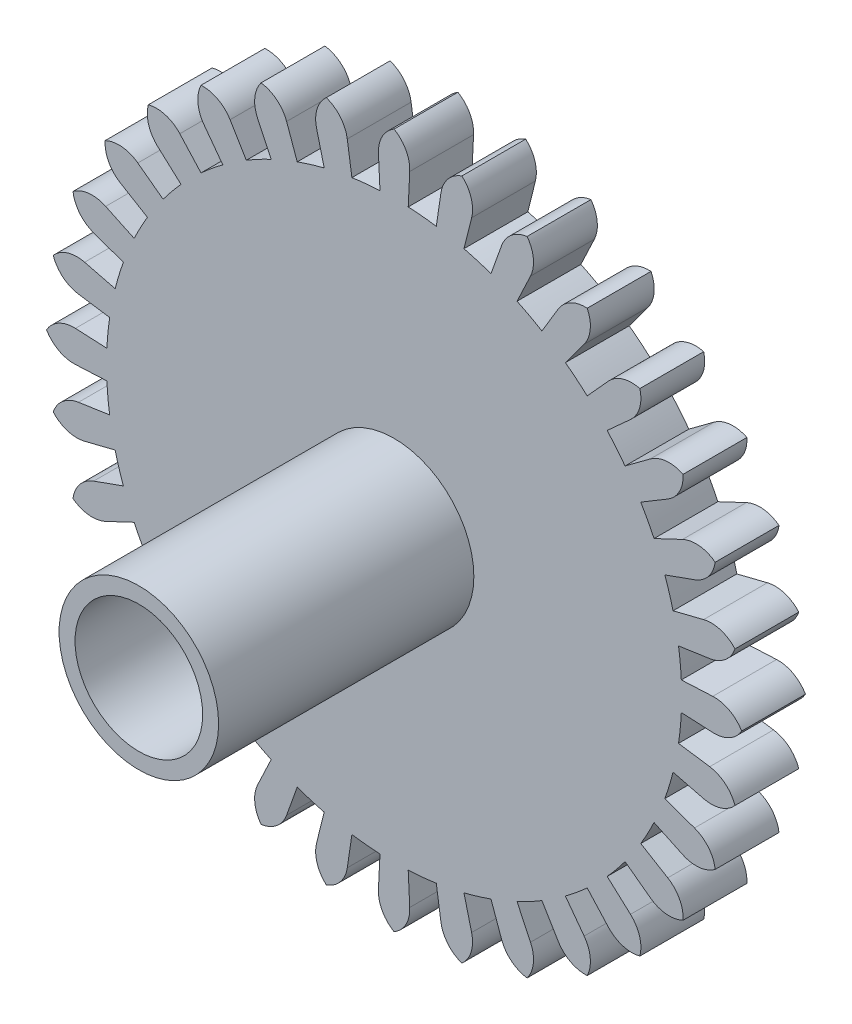
from build123d import *

# Parameters (mm, degrees)
SKETCH2_R           = 1
BOSS_EXTRUDE1_DEPTH = 0.8
SKETCH2_3_R         = 1
SKETCH2_3_R_2       = 0.8
BOSS_EXTRUDE2_DEPTH = 4


with BuildPart() as part:
    # Sketch2 → Boss-Extrude1 (new body)
    with BuildSketch(Plane.XY):
        with BuildLine():
            Line((-0.196290851, 3.995180835), (-0.176907129, 3.600656727))
            ThreePointArc((-0.176907129, 3.600656727), (-0.353351791, 3.58764094), (-0.528945372, 3.565983987))
            Line((-0.528945372, 3.565983987), (-0.586901938, 3.956709001))
            ThreePointArc((-0.586901938, 3.956709001), (-0.674147678, 4.152028122), (-0.850092422, 4.273703204))
            ThreePointArc((-0.850092422, 4.273703204), (-0.966081131, 4.093958948), (-0.971940293, 3.88012011))
            Line((-0.971940293, 3.88012011), (-0.875961189, 3.496958249))
            ThreePointArc((-0.875961189, 3.496958249), (-1.046476262, 3.44976991), (-1.214470799, 3.394272481))
            Line((-1.214470799, 3.394272481), (-1.347540415, 3.766183058))
            ThreePointArc((-1.347540415, 3.766183058), (-1.471214623, 3.940728378), (-1.667516269, 4.025740391))
            ThreePointArc((-1.667516269, 4.025740391), (-1.746209923, 3.826821596), (-1.710238614, 3.615948545))
            Line((-1.710238614, 3.615948545), (-1.541352551, 3.258873626))
            ThreePointArc((-1.541352551, 3.258873626), (-1.699385236, 3.179326158), (-1.853324795, 3.092120988))
            Line((-1.853324795, 3.092120988), (-2.05639367, 3.430924813))
            ThreePointArc((-2.05639367, 3.430924813), (-2.211743615, 3.577988653), (-2.4208584, 3.623070633))
            ThreePointArc((-2.4208584, 3.623070633), (-2.459232846, 3.412621636), (-2.382813425, 3.212818106))
            Line((-2.382813425, 3.212818106), (-2.147510599, 2.895552318))
            ThreePointArc((-2.147510599, 2.895552318), (-2.286987789, 2.786702684), (-2.420956558, 2.671141019))
            Line((-2.420956558, 2.671141019), (-2.686220869, 2.963818052))
            ThreePointArc((-2.686220869, 2.963818052), (-2.86727654, 3.07774883), (-3.081168302, 3.081168302))
            ThreePointArc((-3.081168302, 3.081168302), (-3.07774883, 2.86727654), (-2.963818052, 2.686220869))
            Line((-2.963818052, 2.686220869), (-2.671141019, 2.420956558))
            ThreePointArc((-2.671141019, 2.420956558), (-2.786702684, 2.286987789), (-2.895552318, 2.147510599))
            Line((-2.895552318, 2.147510599), (-3.212818106, 2.382813425))
            ThreePointArc((-3.212818106, 2.382813425), (-3.412621636, 2.459232846), (-3.623070633, 2.4208584))
            ThreePointArc((-3.623070633, 2.4208584), (-3.577988653, 2.211743615), (-3.430924813, 2.05639367))
            Line((-3.430924813, 2.05639367), (-3.092120988, 1.853324795))
            ThreePointArc((-3.092120988, 1.853324795), (-3.179326158, 1.699385236), (-3.258873626, 1.541352551))
            Line((-3.258873626, 1.541352551), (-3.615948545, 1.710238614))
            ThreePointArc((-3.615948545, 1.710238614), (-3.826821596, 1.746209923), (-4.025740391, 1.667516269))
            ThreePointArc((-4.025740391, 1.667516269), (-3.940728378, 1.471214623), (-3.766183058, 1.347540415))
            Line((-3.766183058, 1.347540415), (-3.394272481, 1.214470799))
            ThreePointArc((-3.394272481, 1.214470799), (-3.44976991, 1.046476262), (-3.496958249, 0.875961189))
            Line((-3.496958249, 0.875961189), (-3.88012011, 0.971940293))
            ThreePointArc((-3.88012011, 0.971940293), (-4.093958948, 0.966081131), (-4.273703204, 0.850092422))
            ThreePointArc((-4.273703204, 0.850092422), (-4.152028122, 0.674147678), (-3.956709001, 0.586901938))
            Line((-3.956709001, 0.586901938), (-3.565983987, 0.528945372))
            ThreePointArc((-3.565983987, 0.528945372), (-3.58764094, 0.353351791), (-3.600656727, 0.176907129))
            Line((-3.600656727, 0.176907129), (-3.995180835, 0.196290851))
            ThreePointArc((-3.995180835, 0.196290851), (-4.203767754, 0.148826384), (-4.35743, 0))
            ThreePointArc((-4.35743, 0), (-4.203767754, -0.148826384), (-3.995180835, -0.196290851))
            Line((-3.995180835, -0.196290851), (-3.600656727, -0.176907129))
            ThreePointArc((-3.600656727, -0.176907129), (-3.58764094, -0.353351791), (-3.565983987, -0.528945372))
            Line((-3.565983987, -0.528945372), (-3.956709001, -0.586901938))
            ThreePointArc((-3.956709001, -0.586901938), (-4.152028122, -0.674147678), (-4.273703204, -0.850092422))
            ThreePointArc((-4.273703204, -0.850092422), (-4.093958948, -0.966081131), (-3.88012011, -0.971940293))
            Line((-3.88012011, -0.971940293), (-3.496958249, -0.875961189))
            ThreePointArc((-3.496958249, -0.875961189), (-3.44976991, -1.046476262), (-3.394272481, -1.214470799))
            Line((-3.394272481, -1.214470799), (-3.766183058, -1.347540415))
            ThreePointArc((-3.766183058, -1.347540415), (-3.940728378, -1.471214623), (-4.025740391, -1.667516269))
            ThreePointArc((-4.025740391, -1.667516269), (-3.826821596, -1.746209923), (-3.615948545, -1.710238614))
            Line((-3.615948545, -1.710238614), (-3.258873626, -1.541352551))
            ThreePointArc((-3.258873626, -1.541352551), (-3.179326158, -1.699385236), (-3.092120988, -1.853324795))
            Line((-3.092120988, -1.853324795), (-3.430924813, -2.05639367))
            ThreePointArc((-3.430924813, -2.05639367), (-3.577988653, -2.211743615), (-3.623070633, -2.4208584))
            ThreePointArc((-3.623070633, -2.4208584), (-3.412621636, -2.459232846), (-3.212818106, -2.382813425))
            Line((-3.212818106, -2.382813425), (-2.895552318, -2.147510599))
            ThreePointArc((-2.895552318, -2.147510599), (-2.786702684, -2.286987789), (-2.671141019, -2.420956558))
            Line((-2.671141019, -2.420956558), (-2.963818052, -2.686220869))
            ThreePointArc((-2.963818052, -2.686220869), (-3.07774883, -2.86727654), (-3.081168302, -3.081168302))
            ThreePointArc((-3.081168302, -3.081168302), (-2.86727654, -3.07774883), (-2.686220869, -2.963818052))
            Line((-2.686220869, -2.963818052), (-2.420956558, -2.671141019))
            ThreePointArc((-2.420956558, -2.671141019), (-2.286987789, -2.786702684), (-2.147510599, -2.895552318))
            Line((-2.147510599, -2.895552318), (-2.382813425, -3.212818106))
            ThreePointArc((-2.382813425, -3.212818106), (-2.459232846, -3.412621636), (-2.4208584, -3.623070633))
            ThreePointArc((-2.4208584, -3.623070633), (-2.211743615, -3.577988653), (-2.05639367, -3.430924813))
            Line((-2.05639367, -3.430924813), (-1.853324795, -3.092120988))
            ThreePointArc((-1.853324795, -3.092120988), (-1.699385236, -3.179326158), (-1.541352551, -3.258873626))
            Line((-1.541352551, -3.258873626), (-1.710238614, -3.615948545))
            ThreePointArc((-1.710238614, -3.615948545), (-1.746209923, -3.826821596), (-1.667516269, -4.025740391))
            ThreePointArc((-1.667516269, -4.025740391), (-1.471214623, -3.940728378), (-1.347540415, -3.766183058))
            Line((-1.347540415, -3.766183058), (-1.214470799, -3.394272481))
            ThreePointArc((-1.214470799, -3.394272481), (-1.046476262, -3.44976991), (-0.875961189, -3.496958249))
            Line((-0.875961189, -3.496958249), (-0.971940293, -3.88012011))
            ThreePointArc((-0.971940293, -3.88012011), (-0.966081131, -4.093958948), (-0.850092422, -4.273703204))
            ThreePointArc((-0.850092422, -4.273703204), (-0.674147678, -4.152028122), (-0.586901938, -3.956709001))
            Line((-0.586901938, -3.956709001), (-0.528945372, -3.565983987))
            ThreePointArc((-0.528945372, -3.565983987), (-0.353351791, -3.58764094), (-0.176907129, -3.600656727))
            Line((-0.176907129, -3.600656727), (-0.196290851, -3.995180835))
            ThreePointArc((-0.196290851, -3.995180835), (-0.148826384, -4.203767754), (0, -4.35743))
            ThreePointArc((0, -4.35743), (0.148826384, -4.203767754), (0.196290851, -3.995180835))
            Line((0.196290851, -3.995180835), (0.176907129, -3.600656727))
            ThreePointArc((0.176907129, -3.600656727), (0.353351791, -3.58764094), (0.528945372, -3.565983987))
            Line((0.528945372, -3.565983987), (0.586901938, -3.956709001))
            ThreePointArc((0.586901938, -3.956709001), (0.674147678, -4.152028122), (0.850092422, -4.273703204))
            ThreePointArc((0.850092422, -4.273703204), (0.966081131, -4.093958948), (0.971940293, -3.88012011))
            Line((0.971940293, -3.88012011), (0.875961189, -3.496958249))
            ThreePointArc((0.875961189, -3.496958249), (1.046476262, -3.44976991), (1.214470799, -3.394272481))
            Line((1.214470799, -3.394272481), (1.347540415, -3.766183058))
            ThreePointArc((1.347540415, -3.766183058), (1.471214623, -3.940728378), (1.667516269, -4.025740391))
            ThreePointArc((1.667516269, -4.025740391), (1.746209923, -3.826821596), (1.710238614, -3.615948545))
            Line((1.710238614, -3.615948545), (1.541352551, -3.258873626))
            ThreePointArc((1.541352551, -3.258873626), (1.699385236, -3.179326158), (1.853324795, -3.092120988))
            Line((1.853324795, -3.092120988), (2.05639367, -3.430924813))
            ThreePointArc((2.05639367, -3.430924813), (2.211743615, -3.577988653), (2.4208584, -3.623070633))
            ThreePointArc((2.4208584, -3.623070633), (2.459232846, -3.412621636), (2.382813425, -3.212818106))
            Line((2.382813425, -3.212818106), (2.147510599, -2.895552318))
            ThreePointArc((2.147510599, -2.895552318), (2.286987789, -2.786702684), (2.420956558, -2.671141019))
            Line((2.420956558, -2.671141019), (2.686220869, -2.963818052))
            ThreePointArc((2.686220869, -2.963818052), (2.86727654, -3.07774883), (3.081168302, -3.081168302))
            ThreePointArc((3.081168302, -3.081168302), (3.07774883, -2.86727654), (2.963818052, -2.686220869))
            Line((2.963818052, -2.686220869), (2.671141019, -2.420956558))
            ThreePointArc((2.671141019, -2.420956558), (2.786702684, -2.286987789), (2.895552318, -2.147510599))
            Line((2.895552318, -2.147510599), (3.212818106, -2.382813425))
            ThreePointArc((3.212818106, -2.382813425), (3.412621636, -2.459232846), (3.623070633, -2.4208584))
            ThreePointArc((3.623070633, -2.4208584), (3.577988653, -2.211743615), (3.430924813, -2.05639367))
            Line((3.430924813, -2.05639367), (3.092120988, -1.853324795))
            ThreePointArc((3.092120988, -1.853324795), (3.179326158, -1.699385236), (3.258873626, -1.541352551))
            Line((3.258873626, -1.541352551), (3.615948545, -1.710238614))
            ThreePointArc((3.615948545, -1.710238614), (3.826821596, -1.746209923), (4.025740391, -1.667516269))
            ThreePointArc((4.025740391, -1.667516269), (3.940728378, -1.471214623), (3.766183058, -1.347540415))
            Line((3.766183058, -1.347540415), (3.394272481, -1.214470799))
            ThreePointArc((3.394272481, -1.214470799), (3.44976991, -1.046476262), (3.496958249, -0.875961189))
            Line((3.496958249, -0.875961189), (3.88012011, -0.971940293))
            ThreePointArc((3.88012011, -0.971940293), (4.093958948, -0.966081131), (4.273703204, -0.850092422))
            ThreePointArc((4.273703204, -0.850092422), (4.152028122, -0.674147678), (3.956709001, -0.586901938))
            Line((3.956709001, -0.586901938), (3.565983987, -0.528945372))
            ThreePointArc((3.565983987, -0.528945372), (3.58764094, -0.353351791), (3.600656727, -0.176907129))
            Line((3.600656727, -0.176907129), (3.995180835, -0.196290851))
            ThreePointArc((3.995180835, -0.196290851), (4.203767754, -0.148826384), (4.35743, 0))
            ThreePointArc((4.35743, 0), (4.203767754, 0.148826384), (3.995180835, 0.196290851))
            Line((3.995180835, 0.196290851), (3.600656727, 0.176907129))
            ThreePointArc((3.600656727, 0.176907129), (3.58764094, 0.353351791), (3.565983987, 0.528945372))
            Line((3.565983987, 0.528945372), (3.956709001, 0.586901938))
            ThreePointArc((3.956709001, 0.586901938), (4.152028122, 0.674147678), (4.273703204, 0.850092422))
            ThreePointArc((4.273703204, 0.850092422), (4.093958948, 0.966081131), (3.88012011, 0.971940293))
            Line((3.88012011, 0.971940293), (3.496958249, 0.875961189))
            ThreePointArc((3.496958249, 0.875961189), (3.44976991, 1.046476262), (3.394272481, 1.214470799))
            Line((3.394272481, 1.214470799), (3.766183058, 1.347540415))
            ThreePointArc((3.766183058, 1.347540415), (3.940728378, 1.471214623), (4.025740391, 1.667516269))
            ThreePointArc((4.025740391, 1.667516269), (3.826821596, 1.746209923), (3.615948545, 1.710238614))
            Line((3.615948545, 1.710238614), (3.258873626, 1.541352551))
            ThreePointArc((3.258873626, 1.541352551), (3.179326158, 1.699385236), (3.092120988, 1.853324795))
            Line((3.092120988, 1.853324795), (3.430924813, 2.05639367))
            ThreePointArc((3.430924813, 2.05639367), (3.577988653, 2.211743615), (3.623070633, 2.4208584))
            ThreePointArc((3.623070633, 2.4208584), (3.412621636, 2.459232846), (3.212818106, 2.382813425))
            Line((3.212818106, 2.382813425), (2.895552318, 2.147510599))
            ThreePointArc((2.895552318, 2.147510599), (2.786702684, 2.286987789), (2.671141019, 2.420956558))
            Line((2.671141019, 2.420956558), (2.963818052, 2.686220869))
            ThreePointArc((2.963818052, 2.686220869), (3.07774883, 2.86727654), (3.081168302, 3.081168302))
            ThreePointArc((3.081168302, 3.081168302), (2.86727654, 3.07774883), (2.686220869, 2.963818052))
            Line((2.686220869, 2.963818052), (2.420956558, 2.671141019))
            ThreePointArc((2.420956558, 2.671141019), (2.286987789, 2.786702684), (2.147510599, 2.895552318))
            Line((2.147510599, 2.895552318), (2.382813425, 3.212818106))
            ThreePointArc((2.382813425, 3.212818106), (2.459232846, 3.412621636), (2.4208584, 3.623070633))
            ThreePointArc((2.4208584, 3.623070633), (2.211743615, 3.577988653), (2.05639367, 3.430924813))
            Line((2.05639367, 3.430924813), (1.853324795, 3.092120988))
            ThreePointArc((1.853324795, 3.092120988), (1.699385236, 3.179326158), (1.541352551, 3.258873626))
            Line((1.541352551, 3.258873626), (1.710238614, 3.615948545))
            ThreePointArc((1.710238614, 3.615948545), (1.746209923, 3.826821596), (1.667516269, 4.025740391))
            ThreePointArc((1.667516269, 4.025740391), (1.471214623, 3.940728378), (1.347540415, 3.766183058))
            Line((1.347540415, 3.766183058), (1.214470799, 3.394272481))
            ThreePointArc((1.214470799, 3.394272481), (1.046476262, 3.44976991), (0.875961189, 3.496958249))
            Line((0.875961189, 3.496958249), (0.971940293, 3.88012011))
            ThreePointArc((0.971940293, 3.88012011), (0.966081131, 4.093958948), (0.850092422, 4.273703204))
            ThreePointArc((0.850092422, 4.273703204), (0.674147678, 4.152028122), (0.586901938, 3.956709001))
            Line((0.586901938, 3.956709001), (0.528945372, 3.565983987))
            ThreePointArc((0.528945372, 3.565983987), (0.353351791, 3.58764094), (0.176907129, 3.600656727))
            Line((0.176907129, 3.600656727), (0.196290851, 3.995180835))
            ThreePointArc((0.196290851, 3.995180835), (0.148826384, 4.203767754), (0, 4.35743))
            ThreePointArc((0, 4.35743), (-0.148826384, 4.203767754), (-0.196290851, 3.995180835))
        make_face()
        Circle(SKETCH2_R, mode=Mode.SUBTRACT)
    extrude(amount=BOSS_EXTRUDE1_DEPTH)

    # Sketch2<3> → Boss-Extrude2 (add)
    with BuildSketch(Plane.XY):
        Circle(SKETCH2_3_R)
        Circle(SKETCH2_3_R_2, mode=Mode.SUBTRACT)
    extrude(amount=BOSS_EXTRUDE2_DEPTH)


solid = part.part
